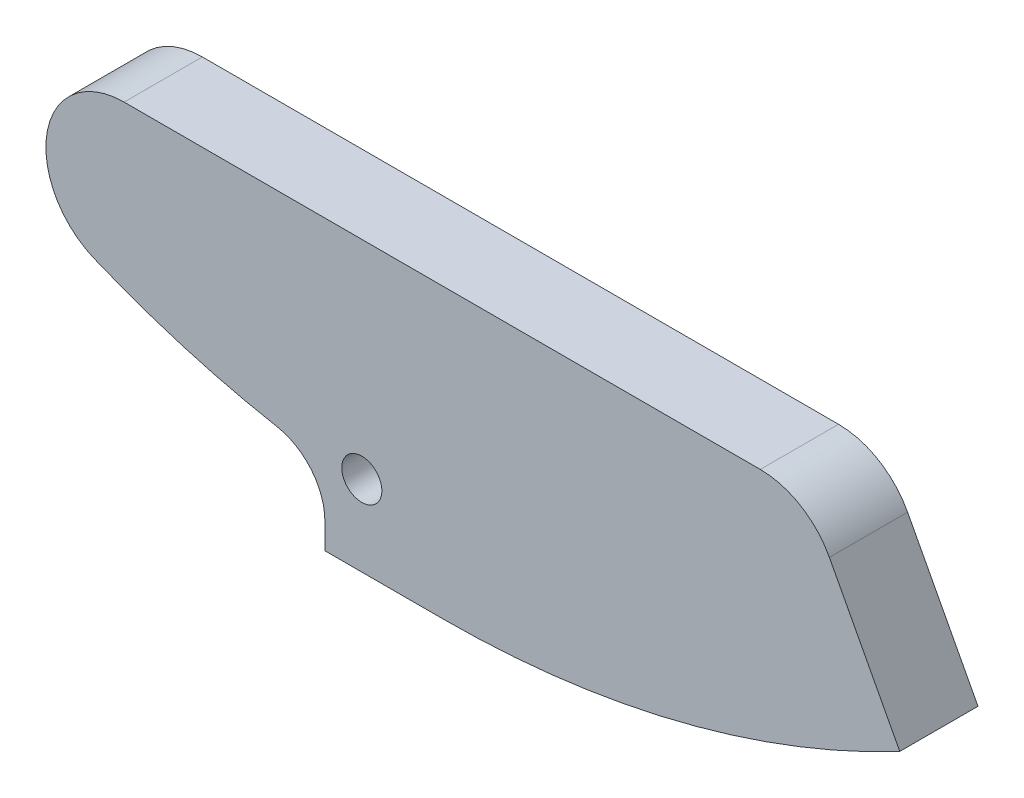
from build123d import *

# Parameters (mm, degrees)
EXTRUDE_1_DEPTH = 4
M2_5X0_45_1_D   = 2.05
FILLET_1_R      = 3


with BuildPart() as part:
    # 草图1 → 凸台-拉伸1 (new body)
    with BuildSketch(Plane.XY):
        with BuildLine():
            Line((0, -50), (-6, -50))
            Line((-6, -50), (-6, -46.111278447))
            ThreePointArc((-6, -46.111278447), (-12.001245585, -44.924604666), (-17.794779605, -42.960398262))
            ThreePointArc((-17.794779605, -42.960398262), (-20.187186997, -38.484518844), (-16.264045876, -35.264880132))
            Line((-16.264045876, -35.264880132), (16.264045876, -35.265962637))
            ThreePointArc((16.264045876, -35.265962637), (18.326373898, -35.838782605), (19.797870689, -37.393136741))
            Line((19.797870689, -37.393136741), (23.396904993, -44.188062152))
            ThreePointArc((23.396904993, -44.188062152), (12.053980513, -48.525267169), (0, -50))
        make_face()
    extrude(amount=EXTRUDE_1_DEPTH)

    # M2.5x0.45 螺纹孔1 (through all)
    with Locations(Plane(origin=(-4.11, -45.89, 4), x_dir=(1, 0, 0), z_dir=(0, 0, 1))):
        with Locations((0, 0)):
            Hole(M2_5X0_45_1_D / 2)

    # 圆角1
    fillet_1_edges = [part.edges().sort_by_distance(p)[0] for p in [
        (-6, -46.111278447, 2),
    ]]
    fillet(fillet_1_edges, radius=FILLET_1_R)


solid = part.part
